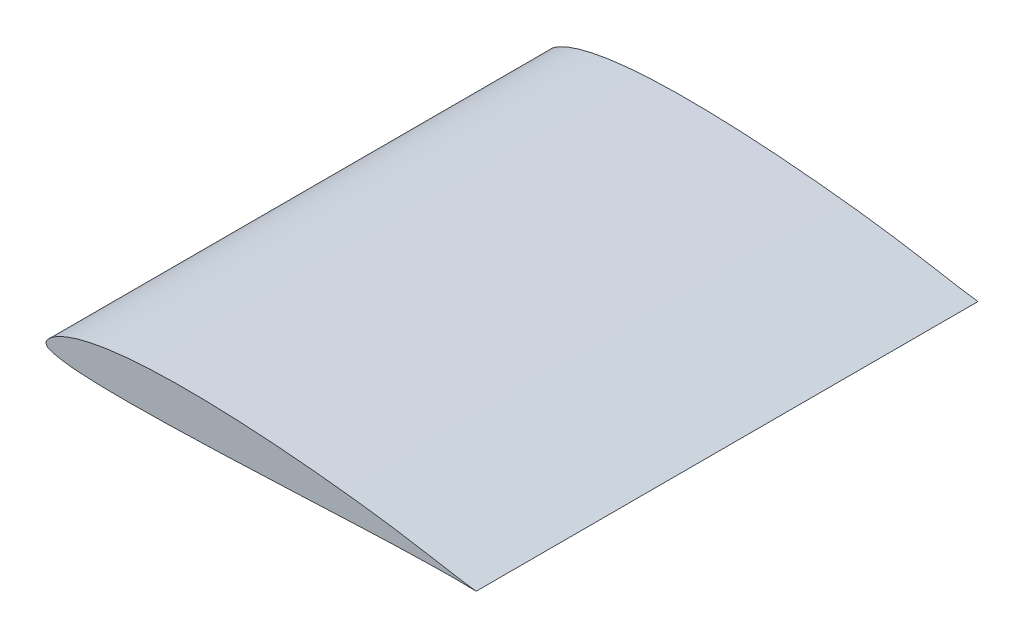
from build123d import *

# Parameters (mm, degrees)
BOSS_EXTRUDE1_DEPTH = 177.8


with BuildPart() as part:
    # Sketch1 → Boss-Extrude1 (new body)
    with BuildSketch(Plane.XY):
        with BuildLine():
            add(Edge.make_bspline(
                [(152.4, 0), (152.232833718, 0.018502415), (151.571843934, 0.091662545), (150.113999557, 0.2838596), (147.749385864, 0.638650629), (144.555943786, 1.170157002), (140.615360499, 1.859099247), (136.007834995, 2.67146013), (130.806388019, 3.562840017), (125.073826155, 4.486154777), (118.864690135, 5.397753278), (112.233312125, 6.272974236), (105.243489487, 7.106058892), (97.969665406, 7.889319693), (90.492724993, 8.606734858), (82.895253241, 9.240670251), (75.258667902, 9.77749908), (67.662928423, 10.198815718), (60.186827499, 10.49170102), (52.905945954, 10.645080099), (45.891743713, 10.644551806), (39.210681048, 10.486247597), (32.923263797, 10.164412711), (27.083700854, 9.670939726), (21.73719754, 9.016508091), (16.924344759, 8.204081974), (12.676275305, 7.249770479), (9.019815693, 6.174457771), (5.965694819, 5.002018522), (3.544032537, 3.769871526), (1.704834708, 2.531499726), (0.575239506, 1.344737529), (-0.170728015, 0.20310696), (0.337603285, -1.001772228), (1.792943226, -1.546726795), (3.794232235, -2.17716446), (6.643400201, -2.643922316), (10.216110654, -3.041953632), (14.530084187, -3.319872228), (19.533969629, -3.497677255), (25.18692206, -3.577638345), (31.428627275, -3.573848082), (38.191948203, -3.496581442), (45.401595317, -3.349308986), (52.97841726, -3.141841288), (60.83867414, -2.885262261), (68.894988424, -2.587930905), (77.057432025, -2.258882887), (85.235009672, -1.907730283), (93.335426834, -1.550168819), (101.266049649, -1.195465221), (108.93417081, -0.862411006), (116.2464986, -0.557504045), (123.110150899, -0.306936183), (129.431690533, -0.107922528), (135.123521438, 0.027974451), (140.103603919, 0.108900525), (144.29941542, 0.13993859), (147.644768246, 0.124243061), (150.083437285, 0.086502888), (151.399782071, 0.04034956), (151.898604, 0.02286)],
                knots=[0, 0, 0, 0, 0.001635356, 0.006466337, 0.014296592, 0.024884209, 0.037943993, 0.053194137, 0.070376569, 0.089257218, 0.109651763, 0.131396199, 0.15429467, 0.178096903, 0.202530723, 0.227328973, 0.252225807, 0.276966075, 0.301296827, 0.324972089, 0.347773046, 0.369493849, 0.389946985, 0.408979416, 0.42646579, 0.442306729, 0.45642124, 0.468773538, 0.47934515, 0.488155641, 0.495223141, 0.500608248, 0.504417036, 0.507344225, 0.511892731, 0.518766333, 0.5280624, 0.539750485, 0.553781924, 0.570059197, 0.588441486, 0.608747967, 0.630750044, 0.65420771, 0.678865071, 0.70445057, 0.730677503, 0.757253937, 0.783882587, 0.810265561, 0.836095192, 0.861073222, 0.884896986, 0.907258357, 0.92785625, 0.946394646, 0.962618154, 0.976286171, 0.987192828, 0.99514679, 1, 1, 1, 1], degree=3))
            Line((151.898604, 0.02286), (152.4, 0))
        make_face()
    extrude(amount=BOSS_EXTRUDE1_DEPTH)


solid = part.part
